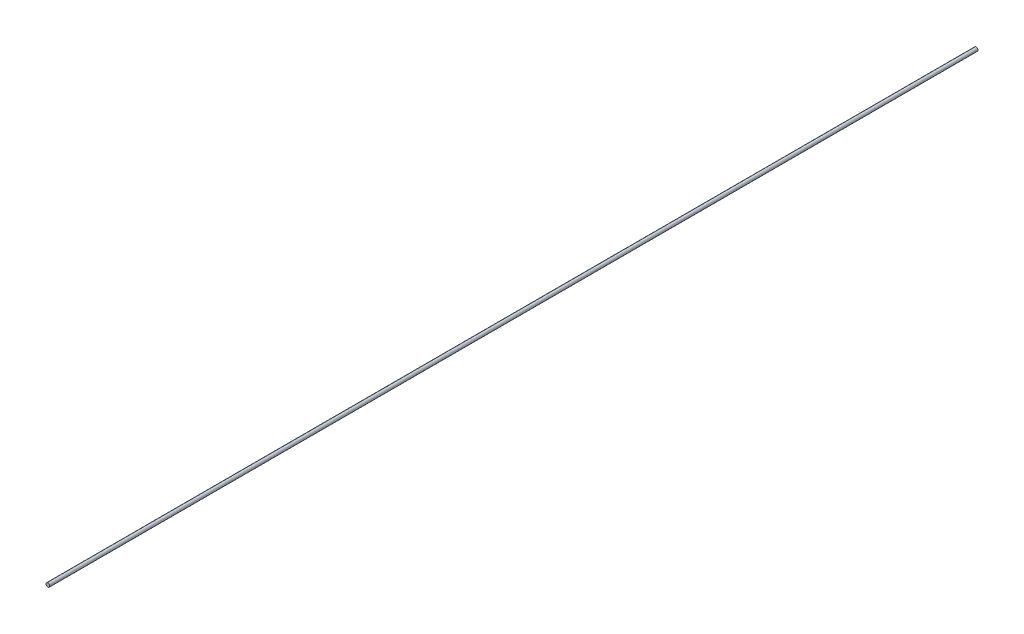
from build123d import *

# Parameters (mm, degrees)
SKETCH_1_R      = 1
EXTRUDE_1_DEPTH = 500


with BuildPart() as part:
    # Эскиз1 → Бобышка-Вытянуть1 (new body)
    with BuildSketch(Plane.XY):
        Circle(SKETCH_1_R)
    extrude(amount=EXTRUDE_1_DEPTH)


solid = part.part
